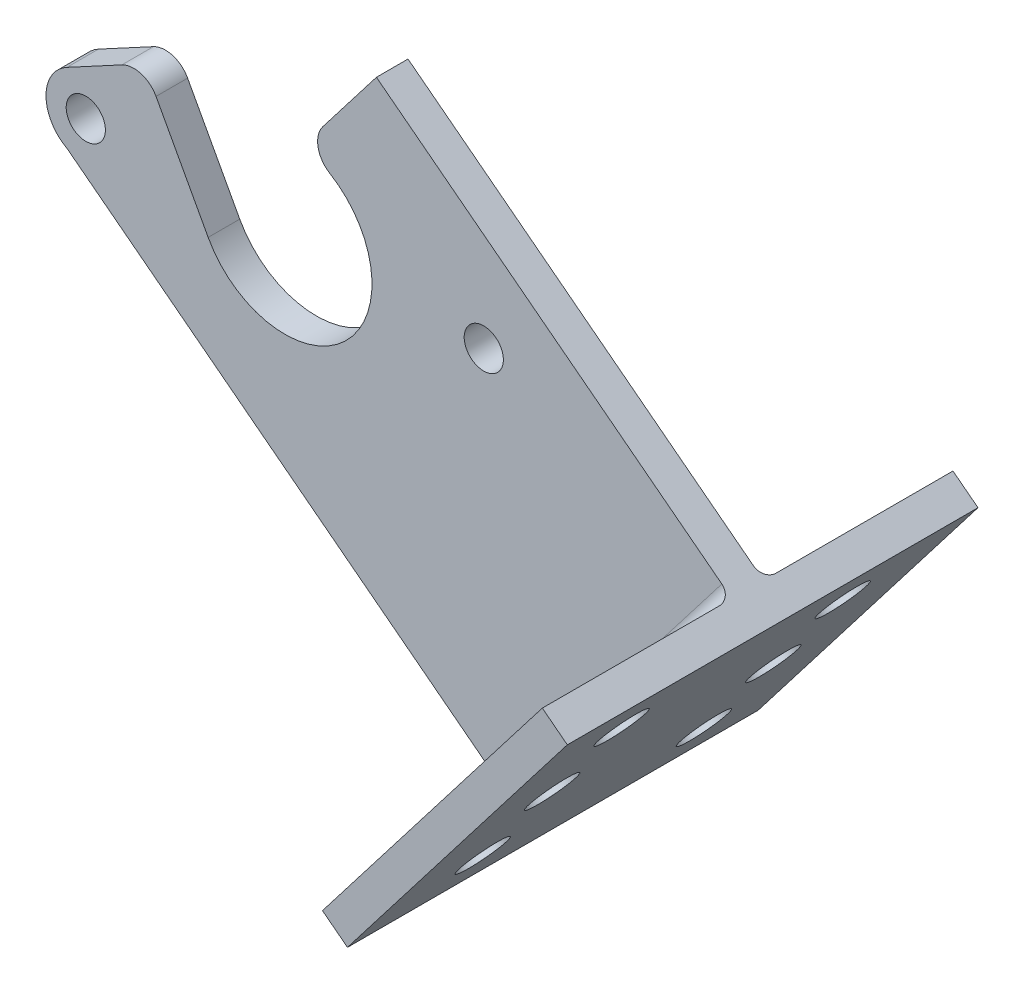
from build123d import *

# Parameters (mm, degrees)
SKETCH1_R           = 3.937
BOSS_EXTRUDE1_DEPTH = 6.35
SKETCH2_W           = 38.1
SKETCH2_H           = 72.406172823
SKETCH2_R           = 4.7625
BOSS_EXTRUDE2_DEPTH = 6.35
FILLET1_R           = 2.54
FILLET2_R           = 5.08


with BuildPart() as part:
    # Sketch1 → Boss-Extrude1 (new body)
    with BuildSketch(Plane.XY):
        with BuildLine():
            ThreePointArc((-16.827513409, -7.862086917), (12.639466563, -9.959944911), (2.148977793, 17.656238065))
            Line((2.148977793, 17.656238065), (16.995641365, 36.92542525))
            Line((16.995641365, 36.92542525), (93.470395294, -21.997399694))
            Line((93.470395294, -21.997399694), (83.897723102, -34.421579135))
            Line((83.897723102, -34.421579135), (54.096930983, -73.099430143))
            Line((54.096930983, -73.099430143), (49.278309192, -79.35342282))
            Line((49.278309192, -79.35342282), (-45.219558371, -6.544018121))
            ThreePointArc((-45.219558371, -6.544018121), (-49.424138371, 0.498338517), (-45.219558371, 7.540695156))
            Line((-45.219558371, 7.540695156), (-29.721187426, 15.893414291))
            Line((-29.721187426, 15.893414291), (-16.827513409, -7.862086917))
        make_face()
        with Locations((-41.424138371, 0.498338517)):
            Circle(SKETCH1_R, mode=Mode.SUBTRACT)
        with Locations((38.575861629, 0.498338517)):
            Circle(SKETCH1_R, mode=Mode.SUBTRACT)
    extrude(amount=BOSS_EXTRUDE1_DEPTH)

    # Sketch2 → Boss-Extrude2 (add)
    # profile 1 of 2: a face of its own
    with BuildSketch(Plane(origin=(69.2868994, -53.384674478, 0), x_dir=(0, 0, -1), z_dir=(0.7921427260999971, -0.6103358923468823, 0))):
        with Locations((19.05, 3.420170547)):
            Rectangle(SKETCH2_W, SKETCH2_H)
        with Locations(Location((19.05, 26.280170547, 0), (0, 0, 90))):
            Circle(SKETCH2_R, mode=Mode.SUBTRACT)
        with Locations(Location((19.05, -19.439829453, 0), (0, 0, 90))):
            Circle(SKETCH2_R, mode=Mode.SUBTRACT)
        with Locations(Location((19.05, 3.420170547, 0), (0, 0, 90))):
            Circle(SKETCH2_R, mode=Mode.SUBTRACT)
    # profile 2 of 2: a face of its own
    with BuildSketch(Plane(origin=(69.2868994, -53.384674478, 0), x_dir=(0, 0, -1), z_dir=(0.7921427260999971, -0.6103358923468823, 0))):
        with Locations((-25.4, 3.420170547)):
            Rectangle(SKETCH2_W, SKETCH2_H)
        with Locations(Location((-25.4, -19.439829453, 0), (0, 0, 90))):
            Circle(SKETCH2_R, mode=Mode.SUBTRACT)
        with Locations(Location((-25.4, 26.280170547, 0), (0, 0, 90))):
            Circle(SKETCH2_R, mode=Mode.SUBTRACT)
        with Locations(Location((-25.4, 3.420170547, 0), (0, 0, 90))):
            Circle(SKETCH2_R, mode=Mode.SUBTRACT)
    extrude(amount=-BOSS_EXTRUDE2_DEPTH)

    # Fillet1
    fillet1_edges = [part.edges().sort_by_distance(p)[0] for p in [
        (66.344245932, -46.799778341, 0),
        (66.344245932, -46.799778341, 6.35),
    ]]
    fillet(fillet1_edges, radius=FILLET1_R)

    # Fillet2
    fillet2_edges = [part.edges().sort_by_distance(p)[0] for p in [
        (2.148977793, 17.656238065, 3.175),
        (-29.721187426, 15.893414291, 3.175),
    ]]
    fillet(fillet2_edges, radius=FILLET2_R)


solid = part.part
